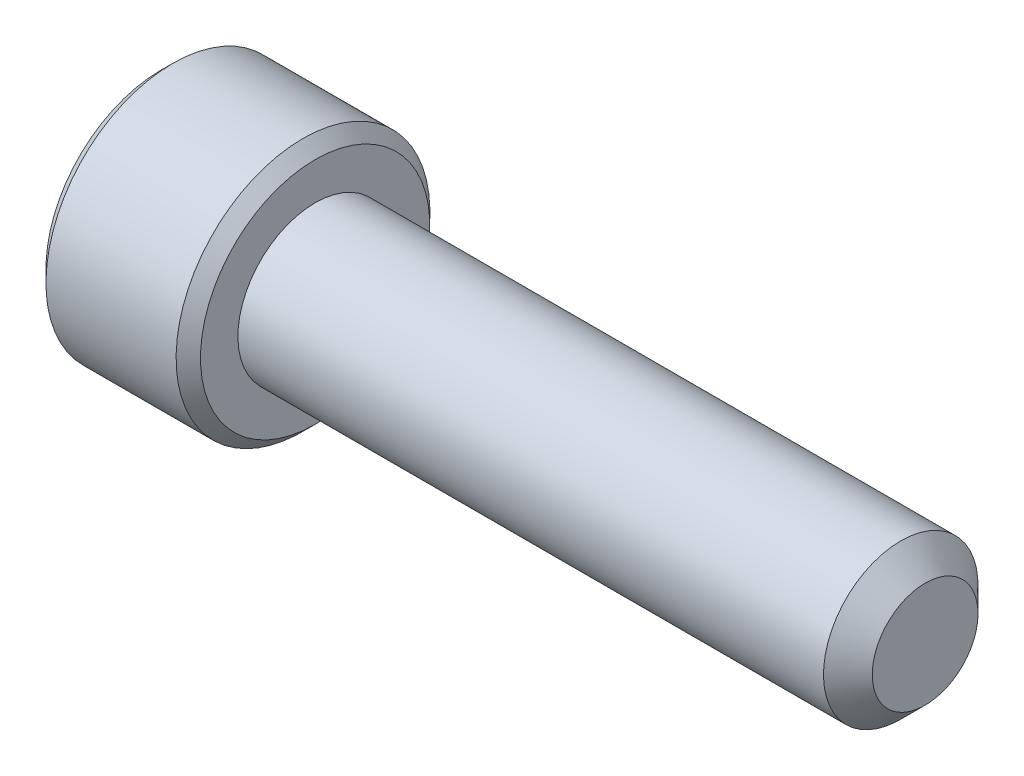
from build123d import *

# Parameters (mm, degrees)
CUT_EXTRUDE1_DEPTH = 2.286


with BuildPart() as part:
    # Sketch1 → Revolve1 (revolve)
    with BuildSketch(Plane.XY):
        Polygon((0, 2.413), (0, 3.5814), (-0.381, 3.9624), (-4.445, 3.9624), (-4.826, 3.5814), (-4.826, 2.291358881), (-2.534641119, 0), (19.05, 0), (19.05, 1.651), (18.288, 2.413), align=None)
    revolve(axis=Axis((-2.534641119, 0, 0), (-1, 0, 0)))

    # Sketch2 → Cut-Extrude1 (cut)
    with BuildSketch(Plane.ZY.offset(4.826)):
        Polygon((0, 2.291358881), (-1.984375, 1.14567944), (-1.984375, -1.14567944), (0, -2.291358881), (1.984375, -1.14567944), (1.984375, 1.14567944), align=None)
    extrude(amount=-CUT_EXTRUDE1_DEPTH, mode=Mode.SUBTRACT)


solid = part.part
